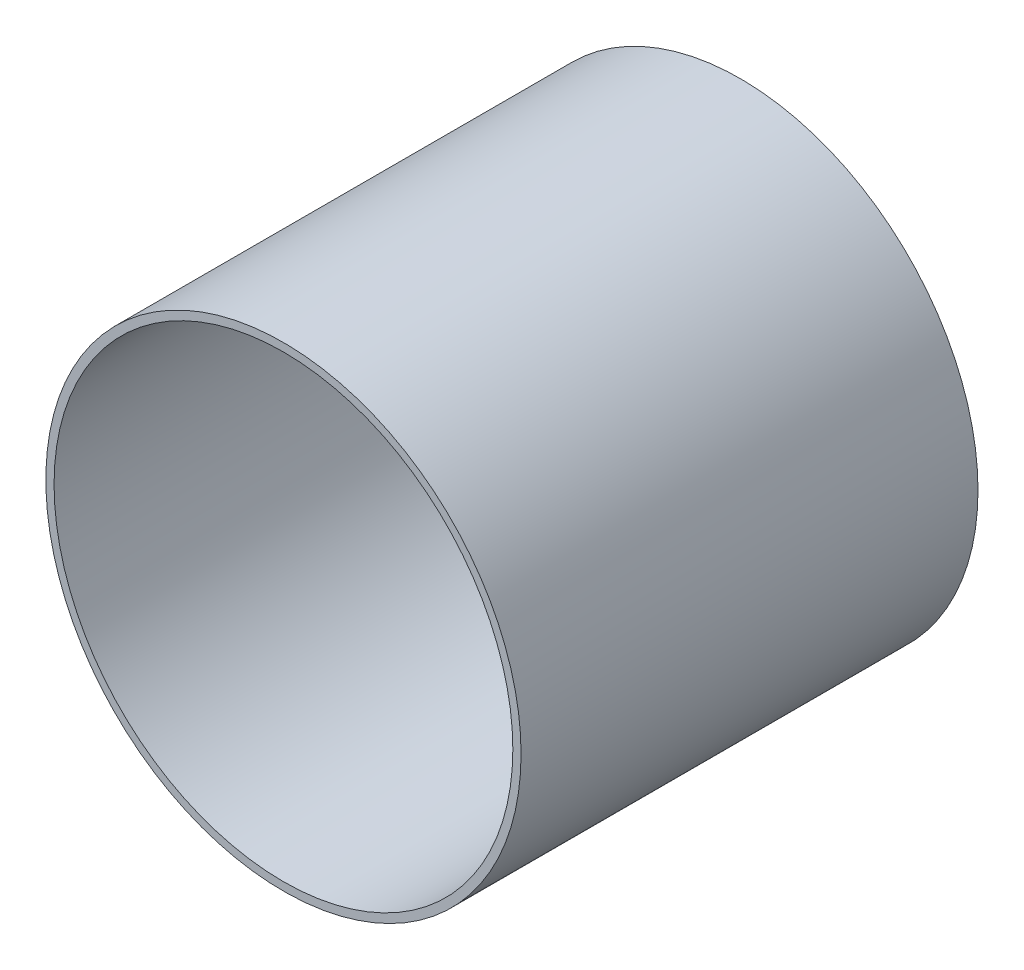
from build123d import *

# Parameters (mm, degrees)
SKETCH1_R           = 13
SKETCH1_R_2         = 12.55
BOSS_EXTRUDE1_DEPTH = 25


with BuildPart() as part:
    # Sketch1 → Boss-Extrude1 (new body)
    with BuildSketch(Plane.XY):
        Circle(SKETCH1_R)
        Circle(SKETCH1_R_2, mode=Mode.SUBTRACT)
    extrude(amount=BOSS_EXTRUDE1_DEPTH)


solid = part.part
